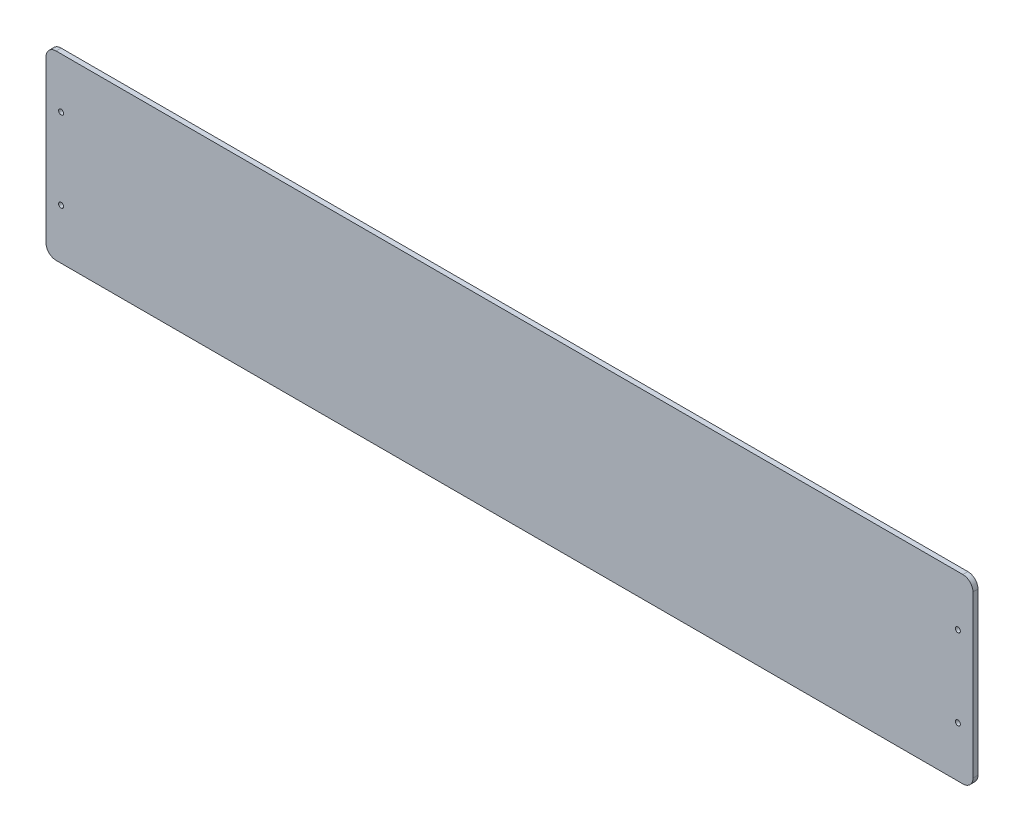
from build123d import *

# Parameters (mm, degrees)
CROQUIS1_W     = 920
CROQUIS1_H     = 180
EXTRUIR1_DEPTH = 5
REDONDEO1_R    = 10
CROQUIS2_R     = 2.5
EXTRUIR2_DEPTH = 10


with BuildPart() as part:
    # Croquis1 → Extruir1 (new body)
    with BuildSketch(Plane.XY):
        Rectangle(CROQUIS1_W, CROQUIS1_H)
    extrude(amount=EXTRUIR1_DEPTH)

    # Redondeo1
    redondeo1_edges = [part.edges().sort_by_distance(p)[0] for p in [
        (-460, 90, 2.5),
        (460, 90, 2.5),
        (460, -90, 2.5),
        (-460, -90, 2.5),
    ]]
    fillet(redondeo1_edges, radius=REDONDEO1_R)

    # Croquis2 → Extruir2 (cut)
    with BuildSketch(Plane.XY.offset(5)):
        with Locations((445, 40)):
            Circle(CROQUIS2_R)
        with Locations((445, -40)):
            Circle(CROQUIS2_R)
        with Locations((-445, 40)):
            Circle(CROQUIS2_R)
        with Locations((-445, -40)):
            Circle(CROQUIS2_R)
    extrude(amount=-EXTRUIR2_DEPTH, mode=Mode.SUBTRACT)


solid = part.part
